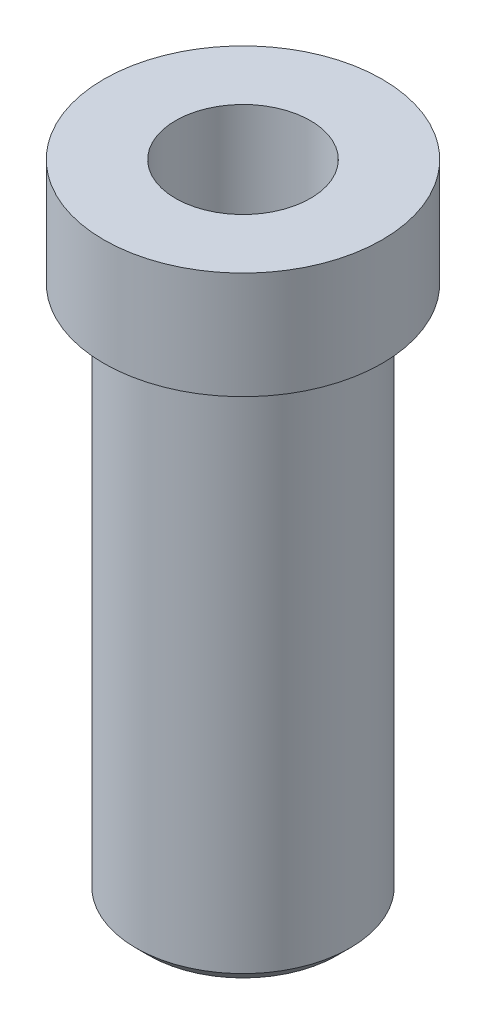
from build123d import *

# Parameters (mm, degrees)
SKETCH2_R          = 0.315
CUT_EXTRUDE1_DEPTH = 4.137674298
CHAMFER1_SIZE      = 0.06


with BuildPart() as part:
    # Sketch1 → Revolve1 (revolve)
    with BuildSketch(Plane.XY, mode=Mode.PRIVATE) as revolve1_sk:
        Polygon((0, 0), (0, 3), (0.65, 3), (0.65, 2.5), (0.5, 2.5), (0.5, 0), align=None)
    revolve(revolve1_sk.sketch.rotate(Axis((0, 0, 0), (0, 1, 0)), 90), axis=Axis((0, 0, 0), (0, 1, 0)))

    # Sketch2 → Cut-Extrude1 (cut, through all)
    with BuildSketch(Plane(origin=(0, 3, 0), x_dir=(1, 0, 0), z_dir=(0, 1, 0))):
        with Locations(Location((0, 0, 0), (0, 0, 270))):
            Circle(SKETCH2_R)
    extrude(amount=-CUT_EXTRUDE1_DEPTH, mode=Mode.SUBTRACT)

    # Chamfer1
    chamfer1_edges = [part.edges().sort_by_distance(p)[0] for p in [
        (0, 0, 0.5),
    ]]
    chamfer(chamfer1_edges, length=CHAMFER1_SIZE)


solid = part.part
